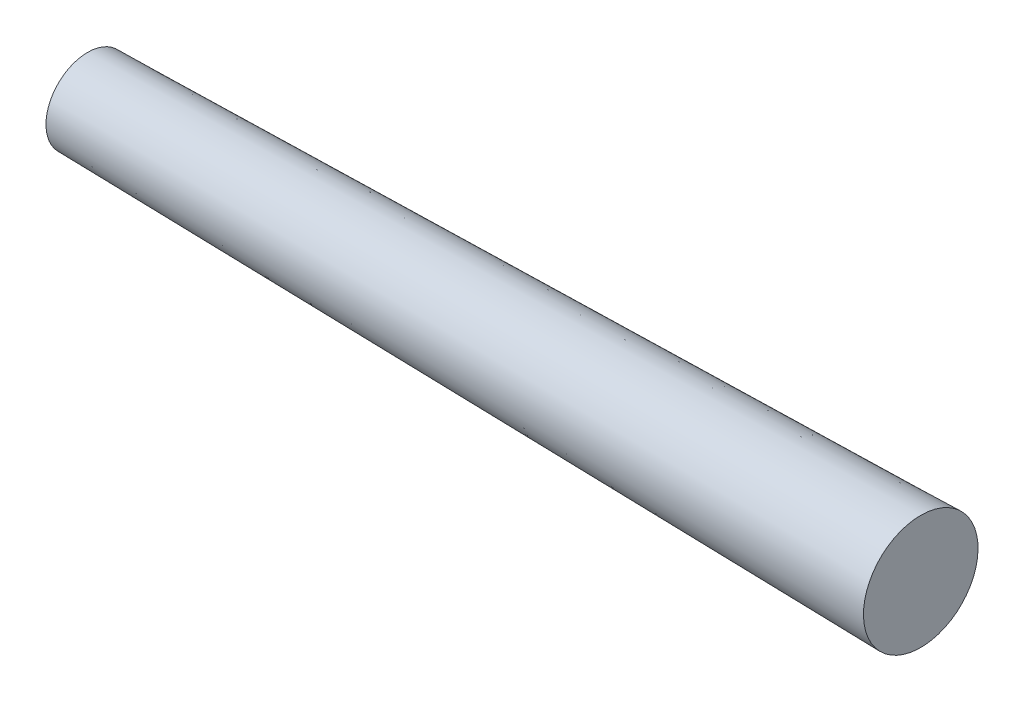
from build123d import *

# Parameters (mm, degrees)
SCHNITT_LINEAR_START            = -5
SKIZZE2_R                       = 2.5
SCHNITT_LINEAR_AUSTRAGEN1_DEPTH = 5
SKIZZE3_R                       = 4
SCHNITT_LINEAR_AUSTRAGEN2_DEPTH = 5


with BuildPart() as part:
    # Skizze1 → Rotation1 (revolve)
    with BuildSketch(Plane.XY):
        Polygon((-38.880400098, 0), (-38.880400098, 2.5), (-33.880400098, 2.5), (-33.880400098, 4), (46.119599902, 5.5), (46.119599902, 4), (51.119599902, 4), (51.119599902, 0), align=None)
    revolve(axis=Axis((51.119599902, 0, 0), (-1, 0, 0)))

    # Skizze2 → Schnitt-Linear austragen1 (cut)
    with BuildSketch(Plane.ZY.offset(38.880400098).offset(SCHNITT_LINEAR_START)):
        Circle(SKIZZE2_R)
    extrude(amount=SCHNITT_LINEAR_AUSTRAGEN1_DEPTH, mode=Mode.SUBTRACT)

    # Skizze3 → Schnitt-Linear austragen2 (cut)
    with BuildSketch(Plane(origin=(51.119599902, 0, 0), x_dir=(0, 0, -1), z_dir=(1, 0, 0))):
        Circle(SKIZZE3_R)
    extrude(amount=-SCHNITT_LINEAR_AUSTRAGEN2_DEPTH, mode=Mode.SUBTRACT)


solid = part.part
